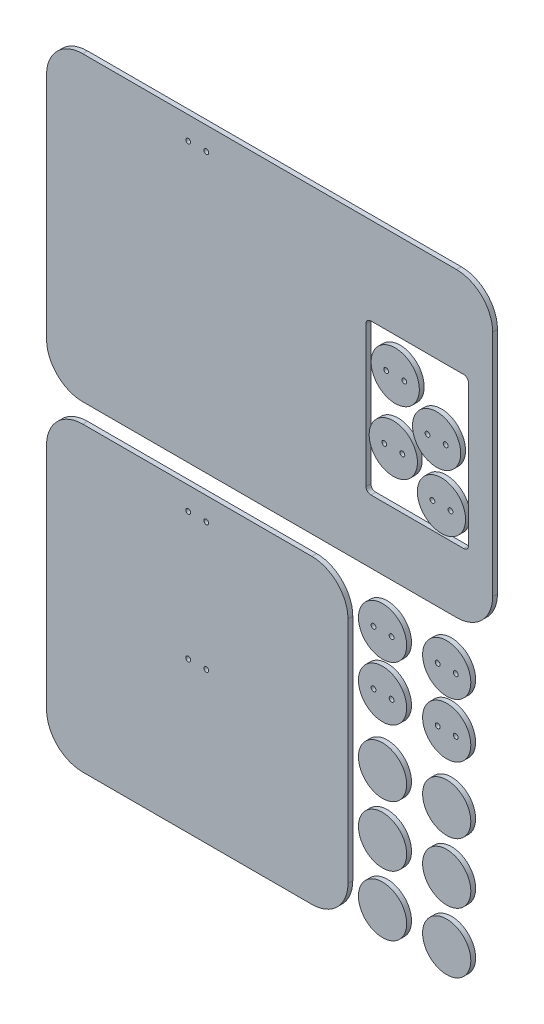
from build123d import *

# Parameters (mm, degrees)
SKETCH1_R              = 2
BOSS_EXTRUDE1_DEPTH    = 4
SKETCH1_R_2            = 20
BOSS_EXTRUDE1_2_DEPTH  = 4
BOSS_EXTRUDE1_3_DEPTH  = 4
BOSS_EXTRUDE1_4_DEPTH  = 4
BOSS_EXTRUDE1_5_DEPTH  = 4
BOSS_EXTRUDE1_6_DEPTH  = 4
BOSS_EXTRUDE1_7_DEPTH  = 4
BOSS_EXTRUDE1_8_DEPTH  = 4
BOSS_EXTRUDE1_9_DEPTH  = 4
BOSS_EXTRUDE1_10_DEPTH = 4
BOSS_EXTRUDE1_11_DEPTH = 4
BOSS_EXTRUDE1_12_DEPTH = 4
BOSS_EXTRUDE1_13_DEPTH = 4
BOSS_EXTRUDE1_14_DEPTH = 4
BOSS_EXTRUDE1_15_DEPTH = 4
BOSS_EXTRUDE1_16_DEPTH = 4


with BuildPart() as part:
    # Sketch1 → Boss-Extrude1 (new body)
    with BuildSketch(Plane.XY):
        with BuildLine():
            ThreePointArc((-146.272220159, -122.138479683), (-167.485423594, -113.351683118), (-176.272220159, -92.138479683))
            Line((-176.272220159, -92.138479683), (-176.272220159, 97.861520317))
            ThreePointArc((-176.272220159, 97.861520317), (-167.485423594, 119.074723753), (-146.272220159, 127.861520317))
            Line((-146.272220159, 127.861520317), (163.727779841, 127.861520317))
            ThreePointArc((163.727779841, 127.861520317), (184.940983277, 119.074723753), (193.727779841, 97.861520317))
            Line((193.727779841, 97.861520317), (193.727779841, -92.138479683))
            ThreePointArc((193.727779841, -92.138479683), (184.940983277, -113.351683118), (163.727779841, -122.138479683))
            Line((163.727779841, -122.138479683), (-146.272220159, -122.138479683))
        make_face()
        with Locations((-43.772220159, 108.861520317)):
            Circle(SKETCH1_R, mode=Mode.SUBTRACT)
        with Locations((-58.772220159, 108.861520317)):
            Circle(SKETCH1_R, mode=Mode.SUBTRACT)
        with BuildLine():
            ThreePointArc((92.727779841, 55.430639332), (89.899352716, 54.259066457), (88.727779841, 51.430639332))
            Line((88.727779841, 51.430639332), (88.727779841, -65.569360668))
            ThreePointArc((88.727779841, -65.569360668), (89.899352716, -68.397787792), (92.727779841, -69.569360668))
            Line((92.727779841, -69.569360668), (169.727779841, -69.569360668))
            ThreePointArc((169.727779841, -69.569360668), (172.556206966, -68.397787792), (173.727779841, -65.569360668))
            Line((173.727779841, -65.569360668), (173.727779841, 51.430639332))
            ThreePointArc((173.727779841, 51.430639332), (172.556206966, 54.259066457), (169.727779841, 55.430639332))
            Line((169.727779841, 55.430639332), (92.727779841, 55.430639332))
        make_face(mode=Mode.SUBTRACT)
    extrude(amount=BOSS_EXTRUDE1_DEPTH)


with BuildPart() as body_2:
    # Sketch1 → Boss-Extrude1 2 (new body)
    with BuildSketch(Plane.XY):
        with Locations((111.344783821, -26.978054874)):
            Circle(SKETCH1_R_2)
        with Locations((103.844783821, -26.978054874)):
            Circle(SKETCH1_R, mode=Mode.SUBTRACT)
        with Locations((118.844783821, -26.978054874)):
            Circle(SKETCH1_R, mode=Mode.SUBTRACT)
    extrude(amount=BOSS_EXTRUDE1_2_DEPTH)


with BuildPart() as body_3:
    # Sketch1 → Boss-Extrude1 3 (new body)
    with BuildSketch(Plane.XY):
        with Locations((147.250062778, -2.495589984)):
            Circle(SKETCH1_R_2)
        with Locations((154.750062778, -2.495589984)):
            Circle(SKETCH1_R, mode=Mode.SUBTRACT)
        with Locations((139.750062778, -2.495589984)):
            Circle(SKETCH1_R, mode=Mode.SUBTRACT)
    extrude(amount=BOSS_EXTRUDE1_3_DEPTH)


with BuildPart() as body_4:
    # Sketch1 → Boss-Extrude1 4 (new body)
    with BuildSketch(Plane.XY):
        with Locations((112.939718361, 26.162949135)):
            Circle(SKETCH1_R_2)
        with Locations((120.439718361, 26.162949135)):
            Circle(SKETCH1_R, mode=Mode.SUBTRACT)
        with Locations((105.439718361, 26.162949135)):
            Circle(SKETCH1_R, mode=Mode.SUBTRACT)
    extrude(amount=BOSS_EXTRUDE1_4_DEPTH)


with BuildPart() as body_5:
    # Sketch1 → Boss-Extrude1 5 (new body)
    with BuildSketch(Plane.XY):
        with Locations((151.286832857, -47.964555215)):
            Circle(SKETCH1_R_2)
        with Locations((158.786832857, -47.964555215)):
            Circle(SKETCH1_R, mode=Mode.SUBTRACT)
        with Locations((143.786832857, -47.964555215)):
            Circle(SKETCH1_R, mode=Mode.SUBTRACT)
    extrude(amount=BOSS_EXTRUDE1_5_DEPTH)


with BuildPart() as body_6:
    # Sketch1 → Boss-Extrude1 6 (new body)
    with BuildSketch(Plane.XY):
        with BuildLine():
            Line((43.727779841, -138.174086968), (-146.272220159, -138.174086968))
            ThreePointArc((-146.272220159, -138.174086968), (-167.485423594, -146.960883532), (-176.272220159, -168.174086968))
            Line((-176.272220159, -168.174086968), (-176.272220159, -358.174086968))
            ThreePointArc((-176.272220159, -358.174086968), (-167.485423594, -379.387290403), (-146.272220159, -388.174086968))
            Line((-146.272220159, -388.174086968), (43.727779841, -388.174086968))
            ThreePointArc((43.727779841, -388.174086968), (64.940983277, -379.387290403), (73.727779841, -358.174086968))
            Line((73.727779841, -358.174086968), (73.727779841, -168.174086968))
            ThreePointArc((73.727779841, -168.174086968), (64.940983277, -146.960883532), (43.727779841, -138.174086968))
        make_face()
        with Locations((-58.772220159, -263.174086968)):
            Circle(SKETCH1_R, mode=Mode.SUBTRACT)
        with Locations((-43.772220159, -263.174086968)):
            Circle(SKETCH1_R, mode=Mode.SUBTRACT)
        with Locations((-43.772220159, -157.174086968)):
            Circle(SKETCH1_R, mode=Mode.SUBTRACT)
        with Locations((-58.772220159, -157.174086968)):
            Circle(SKETCH1_R, mode=Mode.SUBTRACT)
    extrude(amount=BOSS_EXTRUDE1_6_DEPTH)


with BuildPart() as body_7:
    # Sketch1 → Boss-Extrude1 7 (new body)
    with BuildSketch(Plane.XY):
        with Locations((102.42398123, -162.762445388)):
            Circle(SKETCH1_R_2)
        with Locations((109.92398123, -162.762445388)):
            Circle(SKETCH1_R, mode=Mode.SUBTRACT)
        with Locations((94.92398123, -162.762445388)):
            Circle(SKETCH1_R, mode=Mode.SUBTRACT)
    extrude(amount=BOSS_EXTRUDE1_7_DEPTH)


with BuildPart() as body_8:
    # Sketch1 → Boss-Extrude1 8 (new body)
    with BuildSketch(Plane.XY):
        with Locations((155.629452788, -162.762445388)):
            Circle(SKETCH1_R_2)
        with Locations((163.129452788, -162.762445388)):
            Circle(SKETCH1_R, mode=Mode.SUBTRACT)
        with Locations((148.129452788, -162.762445388)):
            Circle(SKETCH1_R, mode=Mode.SUBTRACT)
    extrude(amount=BOSS_EXTRUDE1_8_DEPTH)


with BuildPart() as body_9:
    # Sketch1 → Boss-Extrude1 9 (new body)
    with BuildSketch(Plane.XY):
        with Locations((102.42398123, -207.762445388)):
            Circle(SKETCH1_R_2)
        with Locations((109.92398123, -207.762445388)):
            Circle(SKETCH1_R, mode=Mode.SUBTRACT)
        with Locations((94.92398123, -207.762445388)):
            Circle(SKETCH1_R, mode=Mode.SUBTRACT)
    extrude(amount=BOSS_EXTRUDE1_9_DEPTH)


with BuildPart() as body_10:
    # Sketch1 → Boss-Extrude1 10 (new body)
    with BuildSketch(Plane.XY):
        with Locations((155.629452788, -207.762445388)):
            Circle(SKETCH1_R_2)
        with Locations((163.129452788, -207.762445388)):
            Circle(SKETCH1_R, mode=Mode.SUBTRACT)
        with Locations((148.129452788, -207.762445388)):
            Circle(SKETCH1_R, mode=Mode.SUBTRACT)
    extrude(amount=BOSS_EXTRUDE1_10_DEPTH)


with BuildPart() as body_11:
    # Sketch1 → Boss-Extrude1 11 (new body)
    with BuildSketch(Plane.XY):
        with Locations((102.42398123, -262.762445388)):
            Circle(SKETCH1_R_2)
    extrude(amount=BOSS_EXTRUDE1_11_DEPTH)


with BuildPart() as body_12:
    # Sketch1 → Boss-Extrude1 12 (new body)
    with BuildSketch(Plane.XY):
        with Locations((155.629452788, -262.762445388)):
            Circle(SKETCH1_R_2)
    extrude(amount=BOSS_EXTRUDE1_12_DEPTH)


with BuildPart() as body_13:
    # Sketch1 → Boss-Extrude1 13 (new body)
    with BuildSketch(Plane.XY):
        with Locations((102.42398123, -312.762445388)):
            Circle(SKETCH1_R_2)
    extrude(amount=BOSS_EXTRUDE1_13_DEPTH)


with BuildPart() as body_14:
    # Sketch1 → Boss-Extrude1 14 (new body)
    with BuildSketch(Plane.XY):
        with Locations((155.629452788, -312.762445388)):
            Circle(SKETCH1_R_2)
    extrude(amount=BOSS_EXTRUDE1_14_DEPTH)


with BuildPart() as body_15:
    # Sketch1 → Boss-Extrude1 15 (new body)
    with BuildSketch(Plane.XY):
        with Locations((102.42398123, -362.762445388)):
            Circle(SKETCH1_R_2)
    extrude(amount=BOSS_EXTRUDE1_15_DEPTH)


with BuildPart() as body_16:
    # Sketch1 → Boss-Extrude1 16 (new body)
    with BuildSketch(Plane.XY):
        with Locations((155.629452788, -362.762445388)):
            Circle(SKETCH1_R_2)
    extrude(amount=BOSS_EXTRUDE1_16_DEPTH)


solid = Compound([part.part, body_2.part, body_3.part, body_4.part, body_5.part, body_6.part, body_7.part, body_8.part, body_9.part, body_10.part, body_11.part, body_12.part, body_13.part, body_14.part, body_15.part, body_16.part])
